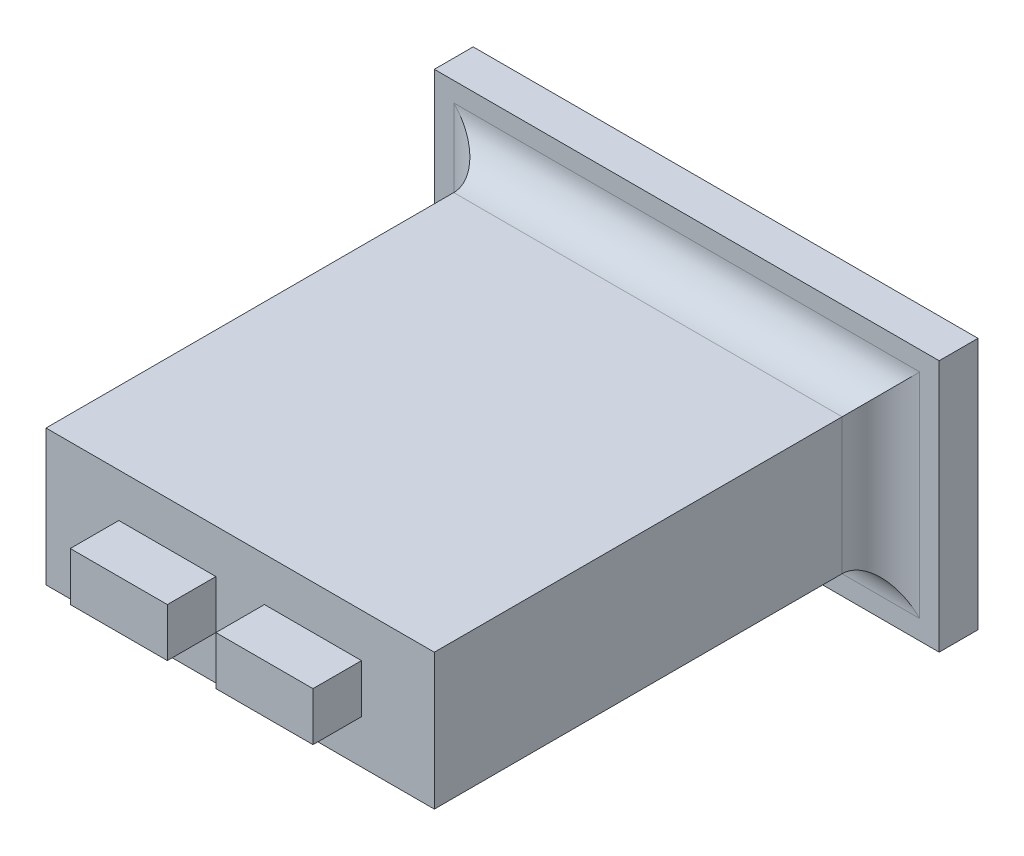
from build123d import *

# Parameters (mm, degrees)
ESQUISSE1_W        = 20
ESQUISSE1_H        = 7
BOSS_EXTRU_1_DEPTH = 23
ESQUISSE2_W        = 5
ESQUISSE2_H        = 2.5
BOSS_EXTRU_2_DEPTH = 2.5
ESQUISSE3_W        = 3
ESQUISSE3_H        = 3
ESQUISSE3_W_2      = 20
ESQUISSE3_H_2      = 7
BOSS_EXTRU_3_DEPTH = 2
CONG_1_R           = 2


with BuildPart() as part:
    # Esquisse1 → Boss.-Extru.1 (new body)
    with BuildSketch(Plane.XY):
        with Locations((10, 3.5)):
            Rectangle(ESQUISSE1_W, ESQUISSE1_H)
    extrude(amount=BOSS_EXTRU_1_DEPTH)

    # Esquisse2 → Boss.-Extru.2 (add)
    with BuildSketch(Plane.XY.offset(23)):
        with Locations((6.25, 3.5)):
            Rectangle(ESQUISSE2_W, ESQUISSE2_H)
        with Locations((13.75, 3.5)):
            Rectangle(ESQUISSE2_W, ESQUISSE2_H)
    extrude(amount=BOSS_EXTRU_2_DEPTH)

    # Esquisse3 → Boss.-Extru.3 (add)
    # profile 1 of 3: a face of its own
    with BuildSketch(Plane(origin=(0, 0, 0), x_dir=(-1, 0, 0), z_dir=(0, 0, -1))):
        with Locations((-21.5, 8.5)):
            Rectangle(ESQUISSE3_W, ESQUISSE3_H)
    # profile 2 of 3: a face of its own
    with BuildSketch(Plane(origin=(0, 0, 0), x_dir=(-1, 0, 0), z_dir=(0, 0, -1))):
        Polygon((-20, 10), (-20, 7), (-23, 7), (-23, -3), (3, -3), (3, 10), align=None)
        with Locations((-10, 3.5)):
            Rectangle(ESQUISSE3_W_2, ESQUISSE3_H_2, mode=Mode.SUBTRACT)
    # profile 3 of 3: a face of its own
    with BuildSketch(Plane(origin=(0, 0, 0), x_dir=(-1, 0, 0), z_dir=(0, 0, -1))):
        with Locations((-10, 3.5)):
            Rectangle(ESQUISSE3_W_2, ESQUISSE3_H_2)
    extrude(amount=BOSS_EXTRU_3_DEPTH)

    # Congé1
    cong_1_edges = [part.edges().sort_by_distance(p)[0] for p in [
        (10, 7, 0),
        (20, 3.5, 0),
        (10, 0, 0),
        (0, 3.5, 0),
    ]]
    fillet(cong_1_edges, radius=CONG_1_R)


solid = part.part
